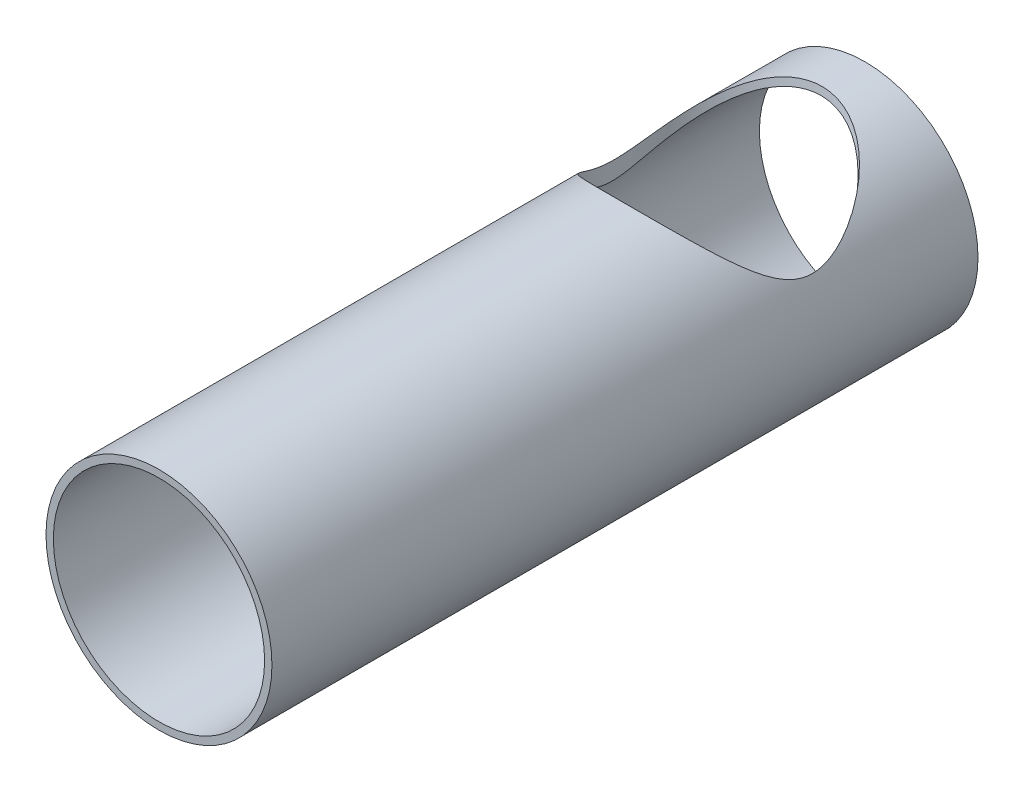
from build123d import *

# Parameters (mm, degrees)
SKETCH1_R           = 25.4
SKETCH1_R_2         = 23.749
BOSS_EXTRUDE1_DEPTH = 158.75
SKETCH2_R           = 22.225
CUT_EXTRUDE2_DEPTH  = 22.86


with BuildPart() as part:
    # Sketch1 → Boss-Extrude1 (new body)
    with BuildSketch(Plane.XY):
        with Locations(Location((0, 0, 0), (0, 0, 180))):
            Circle(SKETCH1_R)
        with Locations(Location((0, 0, 0), (0, 0, 180))):
            Circle(SKETCH1_R_2, mode=Mode.SUBTRACT)
    extrude(amount=BOSS_EXTRUDE1_DEPTH)

    # Sketch2 → Cut-Extrude2 (cut)
    with BuildSketch(Plane(origin=(0, 25.4, 0), x_dir=(-1, 0, 0), z_dir=(0, -0.9890158633619168, 0.1478094111296106))):
        with Locations(Location((0, -31.75, 0), (0, 0, 270))):
            Circle(SKETCH2_R)
    extrude(amount=CUT_EXTRUDE2_DEPTH, mode=Mode.SUBTRACT)


solid = part.part
